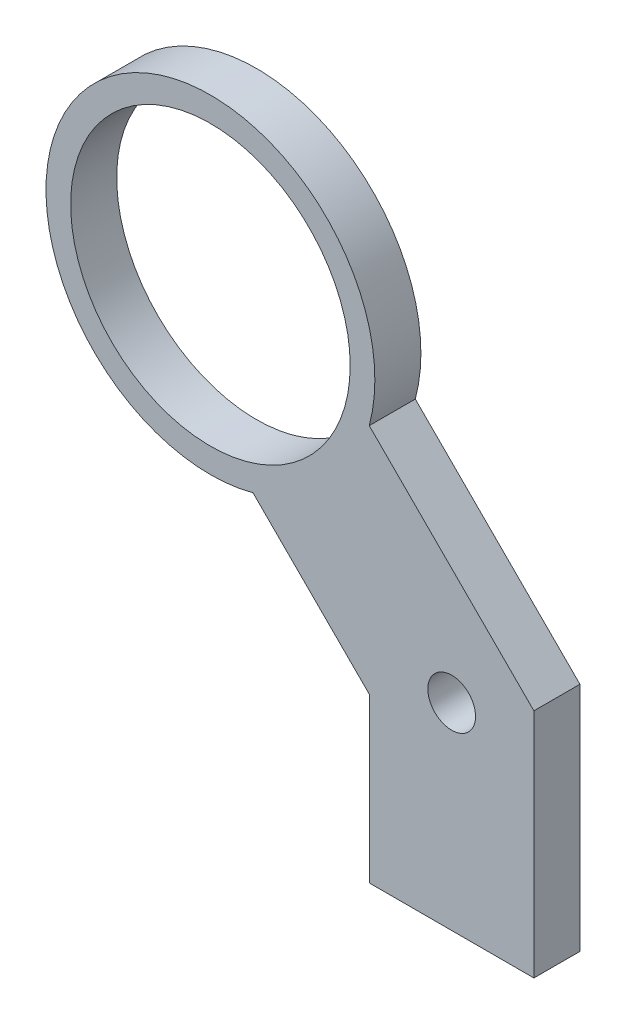
from build123d import *

# Parameters (mm, degrees)
SKETCH1_R           = 2.9
BOSS_EXTRUDE1_DEPTH = 5.6
SKETCH2_R           = 17
CUT_EXTRUDE1_DEPTH  = 71.008603139


with BuildPart() as part:
    # Sketch1 → Boss-Extrude1 (new body)
    with BuildSketch(Plane.XY):
        with BuildLine():
            Line((-10, -4.142135624), (-10, -24))
            Line((-10, -24), (10, -24))
            Line((10, -24), (10, 4.142135624))
            Line((10, 4.142135624), (-10.026414893, 24.168550517))
            ThreePointArc((-10.026414893, 24.168550517), (-43.487067043, 43.487067043), (-24.168550517, 10.026414893))
            Line((-24.168550517, 10.026414893), (-10, -4.142135624))
        make_face()
        Circle(SKETCH1_R, mode=Mode.SUBTRACT)
    extrude(amount=BOSS_EXTRUDE1_DEPTH)

    # Sketch2 → Cut-Extrude1 (cut, through all)
    with BuildSketch(Plane.XY.offset(5.6)):
        with Locations((-29.344931419, 29.344931419)):
            Circle(SKETCH2_R)
    extrude(amount=-CUT_EXTRUDE1_DEPTH, mode=Mode.SUBTRACT)


solid = part.part
